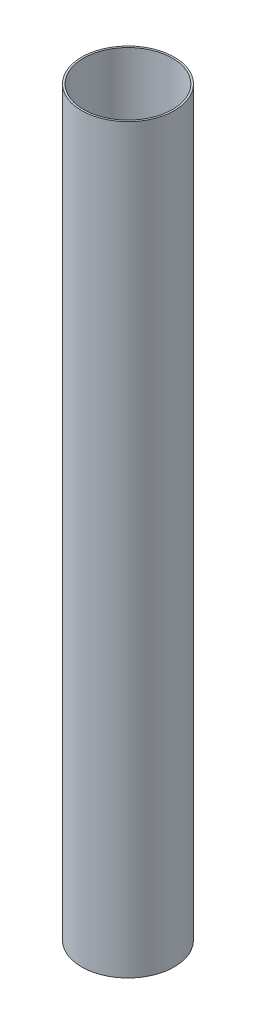
from build123d import *

# Parameters (mm, degrees)
PROFILES_W = 0.5
PROFILES_H = 200


with BuildPart() as part:
    # ProfileS → Profile (revolve)
    with BuildSketch(Plane.XY):
        with Locations((-12.25, 0)):
            Rectangle(PROFILES_W, PROFILES_H)
    revolve(axis=Axis((0, 100, 0), (0, -1, 0)))


solid = part.part
